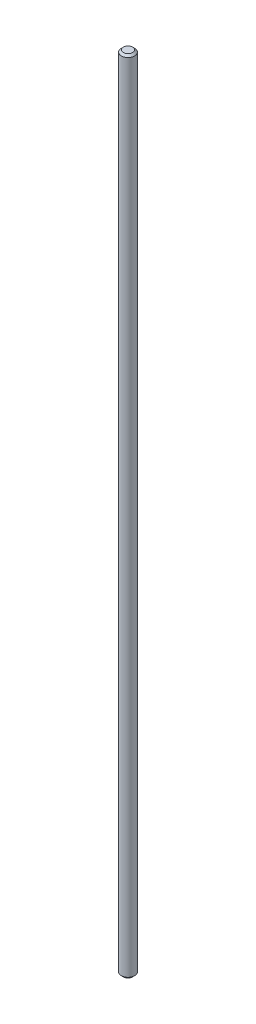
from build123d import *

# Parameters (mm, degrees)
SKETCH1_R           = 2.5
BOSS_EXTRUDE1_DEPTH = 300
CHAMFER1_SIZE       = 0.75


with BuildPart() as part:
    # Sketch1 → Boss-Extrude1 (new body)
    with BuildSketch(Plane(origin=(0, 0, 0), x_dir=(1, 0, 0), z_dir=(0, 1, 0))):
        with Locations(Location((0, 0, 0), (0, 0, 270))):
            Circle(SKETCH1_R)
    extrude(amount=BOSS_EXTRUDE1_DEPTH)

    # Chamfer1
    chamfer1_edges = [part.edges().sort_by_distance(p)[0] for p in [
        (0, 0, -2.5),
        (0, 300, -2.5),
    ]]
    chamfer(chamfer1_edges, length=CHAMFER1_SIZE)


solid = part.part
